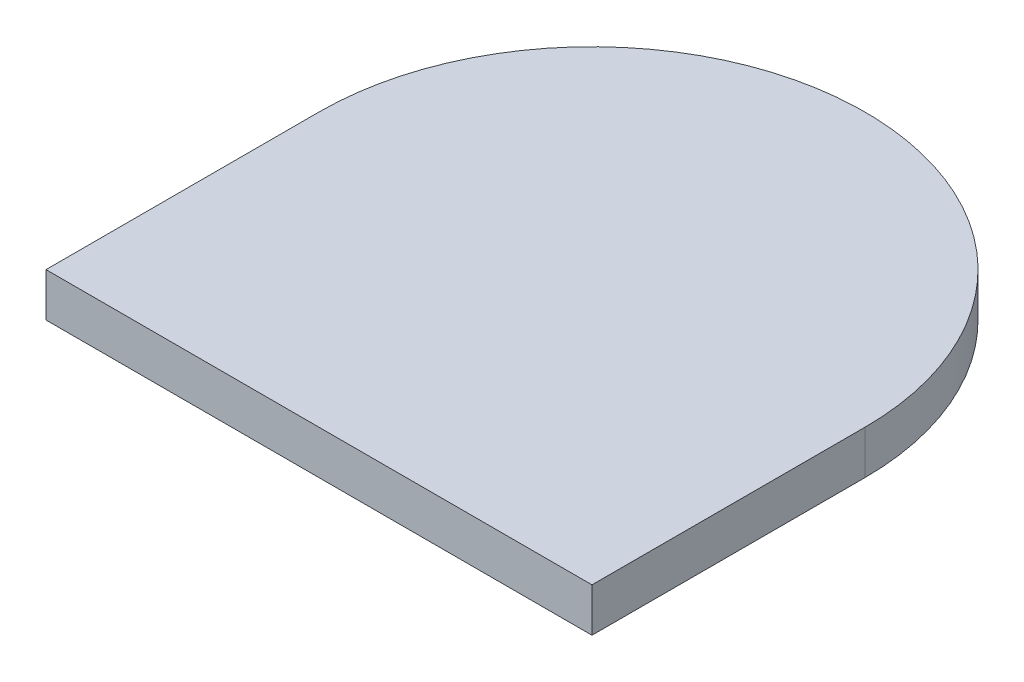
from build123d import *

# Parameters (mm, degrees)
SKETCH1_R           = 25
BOSS_EXTRUDE1_DEPTH = 3
BOSS_EXTRUDE2_START = -4
BOSS_EXTRUDE2_DEPTH = 4


with BuildPart() as part:
    # Sketch1 → Boss-Extrude1 (new body)
    with BuildSketch(Plane(origin=(0, 0, 0), x_dir=(1, 0, 0), z_dir=(0, 1, 0))):
        with Locations(Location((0, 0, 0), (0, 0, 270))):
            Circle(SKETCH1_R)
    extrude(amount=BOSS_EXTRUDE1_DEPTH)

    # Sketch2 → Boss-Extrude2 (add)
    with BuildSketch(Plane(origin=(0, 3, 0), x_dir=(1, 0, 0), z_dir=(0, 1, 0)).offset(BOSS_EXTRUDE2_START)):
        with BuildLine():
            Line((0, -25), (25, -25))
            Line((25, -25), (25, 0))
            ThreePointArc((25, 0), (0, 25), (-25, 0))
            Line((-25, 0), (-25, -25))
            Line((-25, -25), (0, -25))
        make_face()
    extrude(amount=BOSS_EXTRUDE2_DEPTH)


solid = part.part
